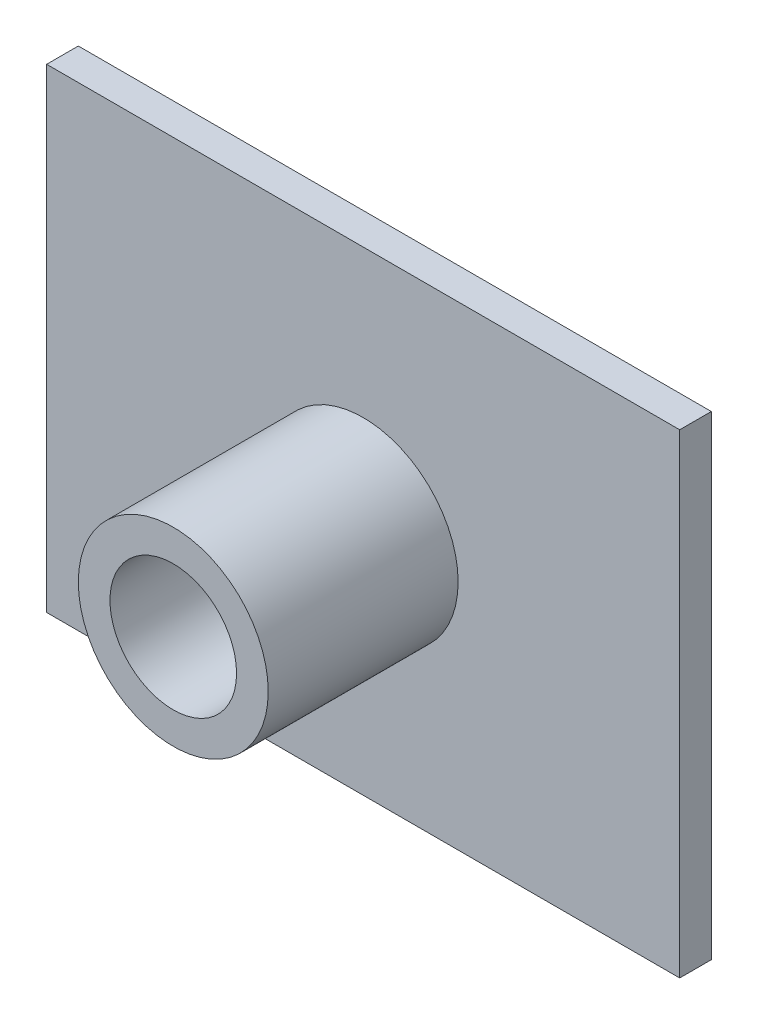
from build123d import *

# Parameters (mm, degrees)
SKETCH2_W           = 25.4
SKETCH2_H           = 19.05
BOSS_EXTRUDE1_DEPTH = 1.27
SKETCH3_R           = 3.81
BOSS_EXTRUDE2_DEPTH = 7.62
SKETCH4_R           = 2.54
CUT_EXTRUDE1_DEPTH  = 7.366


with BuildPart() as part:
    # Sketch2 → Boss-Extrude1 (new body)
    with BuildSketch(Plane.XY):
        with Locations((12.7, -9.525)):
            Rectangle(SKETCH2_W, SKETCH2_H)
    extrude(amount=BOSS_EXTRUDE1_DEPTH)

    # Sketch3 → Boss-Extrude2 (add)
    with BuildSketch(Plane.XY.offset(1.27)):
        with Locations(Location((12.7, -9.733398963, 0), (0, 0, 180))):
            Circle(SKETCH3_R)
    extrude(amount=BOSS_EXTRUDE2_DEPTH)

    # Sketch4 → Cut-Extrude1 (cut)
    with BuildSketch(Plane.XY.offset(8.89)):
        with Locations((12.7, -9.733398963)):
            Circle(SKETCH4_R)
    extrude(amount=-CUT_EXTRUDE1_DEPTH, mode=Mode.SUBTRACT)


solid = part.part
